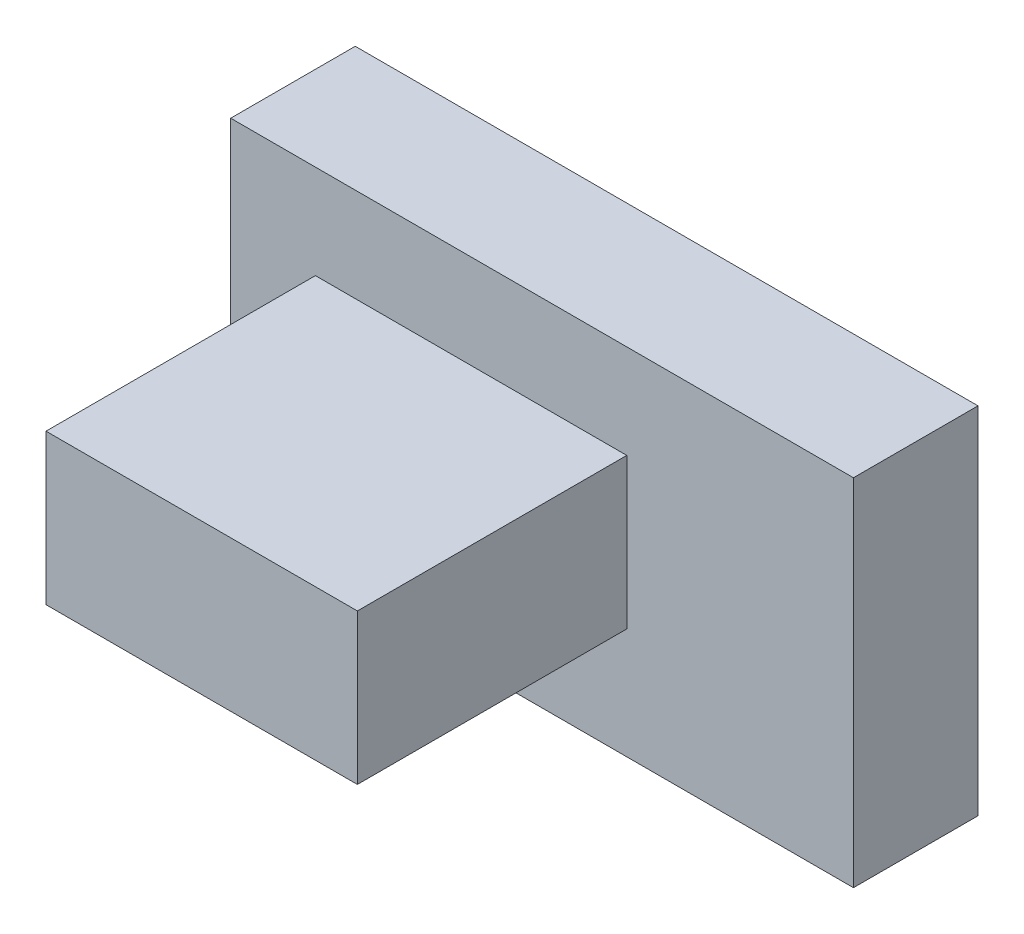
from build123d import *

# Parameters (mm, degrees)
SQUARE_W            = 127
SQUARE_H            = 72.407264375
BOSS_EXTRUDE4_DEPTH = 25.4
SKETCH3_W           = 63.5
SKETCH3_H           = 30.647831643
BOSS_EXTRUDE5_DEPTH = 54.938383124


with BuildPart() as part:
    # square → Boss-Extrude4 (new body)
    with BuildSketch(Plane.XY):
        with Locations((63.5, 36.203632188)):
            Rectangle(SQUARE_W, SQUARE_H)
    extrude(amount=BOSS_EXTRUDE4_DEPTH)

    # Sketch3 → Boss-Extrude5 (add)
    with BuildSketch(Plane.XY.offset(25.4)):
        with Locations((49.021914985, 37.914426279)):
            Rectangle(SKETCH3_W, SKETCH3_H)
    extrude(amount=BOSS_EXTRUDE5_DEPTH)


solid = part.part
